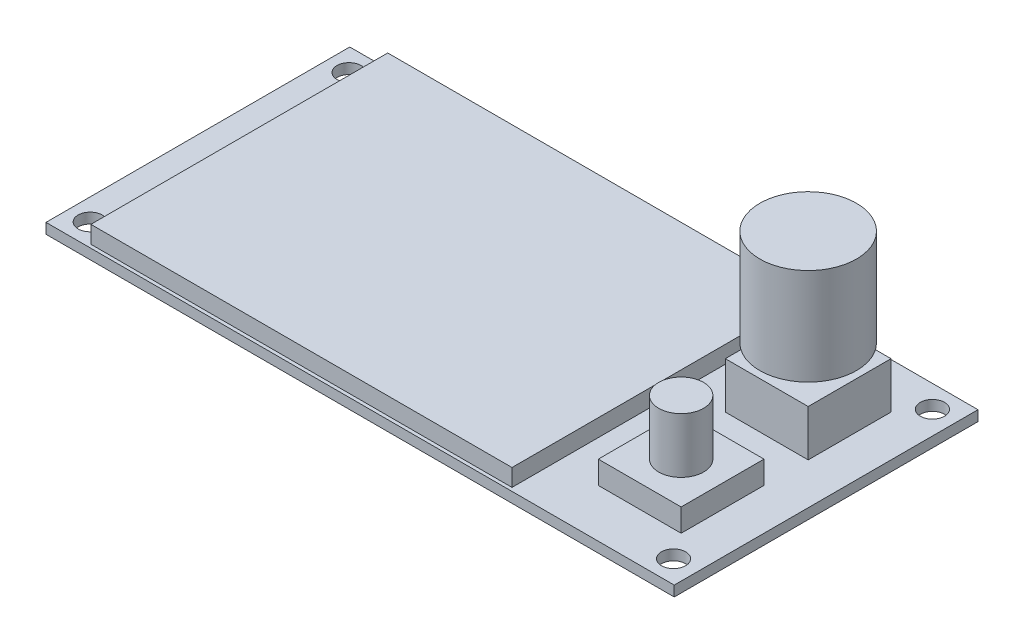
from build123d import *

# Parameters (mm, degrees)
SKETCH_1_W          = 91
SKETCH_1_H          = 44
EXTRUDE_1_DEPTH     = 1.5
SKETCH_2_W          = 61
SKETCH_2_H          = 43
EXTRUDE_2_DEPTH     = 2.5
SKETCH_3_R          = 1.75
CUT_EXTRUDE_1_DEPTH = 2.5
SKETCH_4_W          = 12
SKETCH_4_H          = 12
EXTRUDE_3_DEPTH     = 6.7
SKETCH_5_W          = 12
SKETCH_5_H          = 12
CUT_EXTRUDE_2_DEPTH = 3.4
SKETCH_6_R          = 1
EXTRUDE_4_DEPTH     = 2
SKETCH_7_R          = 7
EXTRUDE_5_DEPTH     = 14
SKETCH_8_R          = 3.25
EXTRUDE_6_DEPTH     = 8


with BuildPart() as part:
    # 草图1 → 凸台-拉伸1 (new body)
    with BuildSketch(Plane(origin=(0, 0, 0), x_dir=(1, 0, 0), z_dir=(0, 1, 0))):
        with Locations((45.5, 22)):
            Rectangle(SKETCH_1_W, SKETCH_1_H)
    extrude(amount=EXTRUDE_1_DEPTH)

    # 草图2 → 凸台-拉伸2 (add)
    with BuildSketch(Plane(origin=(0, 1.5, 0), x_dir=(1, 0, 0), z_dir=(0, 1, 0))):
        with Locations((36.5, 22)):
            Rectangle(SKETCH_2_W, SKETCH_2_H)
    extrude(amount=EXTRUDE_2_DEPTH)

    # 草图3 → 切除-拉伸1 (cut)
    with BuildSketch(Plane(origin=(0, 1.5, 0), x_dir=(1, 0, 0), z_dir=(0, 1, 0))):
        with Locations(Location((87.65, 40.75, 0), (0, 0, 270))):
            Circle(SKETCH_3_R)
        with Locations(Location((87.65, 3.25, 0), (0, 0, 270))):
            Circle(SKETCH_3_R)
        with Locations(Location((3.15, 3.25, 0), (0, 0, 270))):
            Circle(SKETCH_3_R)
        with Locations(Location((3.15, 40.75, 0), (0, 0, 270))):
            Circle(SKETCH_3_R)
    extrude(amount=-CUT_EXTRUDE_1_DEPTH, mode=Mode.SUBTRACT)

    # 草图4 → 凸台-拉伸3 (add)
    with BuildSketch(Plane(origin=(0, 1.5, 0), x_dir=(1, 0, 0), z_dir=(0, 1, 0))):
        with Locations((79, 31.4)):
            Rectangle(SKETCH_4_W, SKETCH_4_H)
        with Locations((79, 13)):
            Rectangle(SKETCH_4_W, SKETCH_4_H)
    extrude(amount=EXTRUDE_3_DEPTH)

    # 草图5 → 切除-拉伸2 (cut)
    with BuildSketch(Plane(origin=(0, 8.2, 0), x_dir=(1, 0, 0), z_dir=(0, 1, 0))):
        with Locations((79, 13)):
            Rectangle(SKETCH_5_W, SKETCH_5_H)
    extrude(amount=-CUT_EXTRUDE_2_DEPTH, mode=Mode.SUBTRACT)

    # 草图6 → 凸台-拉伸4 (add)
    with BuildSketch(Plane(origin=(0, 8.2, 0), x_dir=(1, 0, 0), z_dir=(0, 1, 0))):
        with Locations(Location((79, 31.4, 0), (0, 0, 270))):
            Circle(SKETCH_6_R)
    extrude(amount=EXTRUDE_4_DEPTH)

    # 草图7 → 凸台-拉伸5 (add)
    with BuildSketch(Plane(origin=(0, 10.2, 0), x_dir=(1, 0, 0), z_dir=(0, 1, 0))):
        with Locations(Location((79, 31.4, 0), (0, 0, 270))):
            Circle(SKETCH_7_R)
    extrude(amount=EXTRUDE_5_DEPTH)

    # 草图8 → 凸台-拉伸6 (add)
    with BuildSketch(Plane(origin=(0, 4.8, 0), x_dir=(1, 0, 0), z_dir=(0, 1, 0))):
        with Locations(Location((79, 13, 0), (0, 0, 270))):
            Circle(SKETCH_8_R)
    extrude(amount=EXTRUDE_6_DEPTH)


solid = part.part
